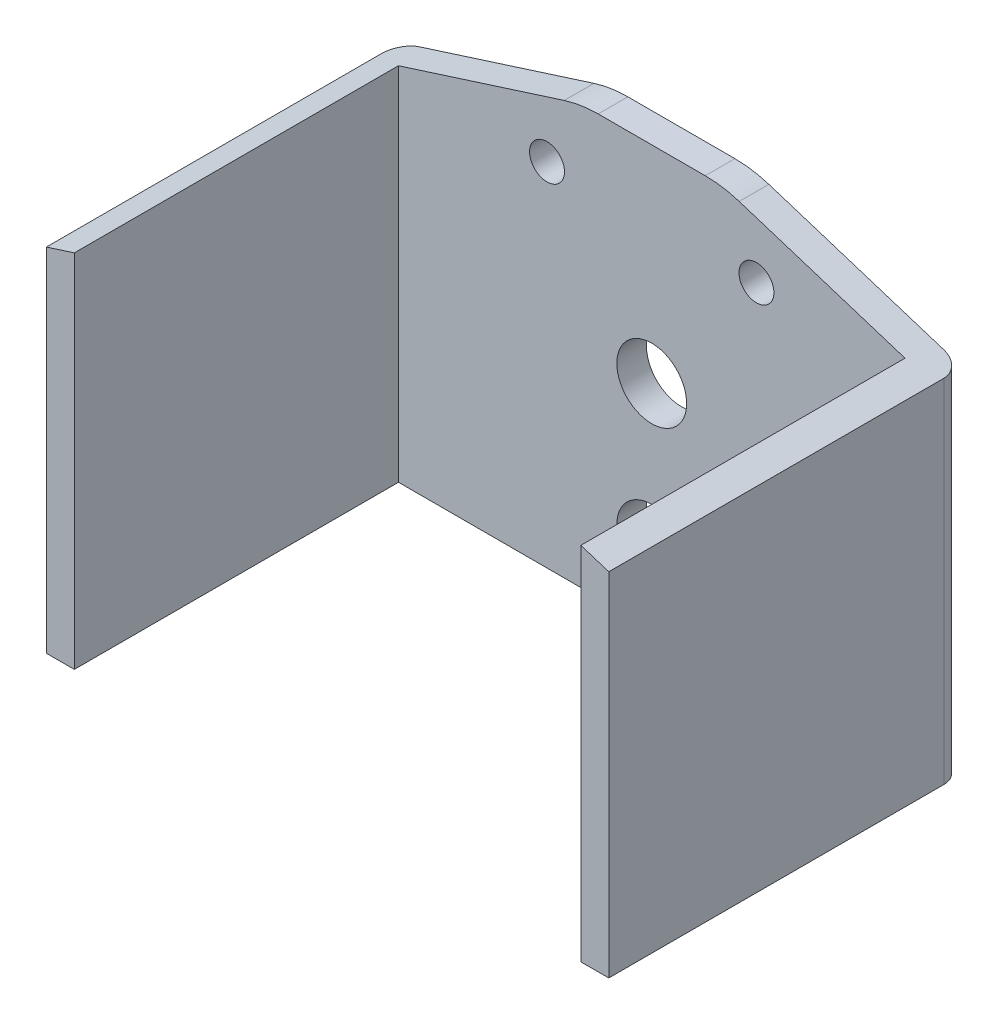
from build123d import *

# Parameters (mm, degrees)
BOSS_EXTRUDE1_DEPTH = 19.05
SKETCH9_R           = 1.5875
SKETCH9_R_2         = 0.79375
CUT_EXTRUDE3_DEPTH  = 29.02437948
FILLET1_R           = 5.08


with BuildPart() as part:
    # Sketch8 → Boss-Extrude1 (new body)
    with BuildSketch(Plane(origin=(0, 0, 0), x_dir=(1, 0, 0), z_dir=(0, 1, 0))):
        with BuildLine():
            Line((-11.938, 0), (11.938, 0))
            ThreePointArc((11.938, 0), (12.539558645, -0.249173749), (12.788732394, -0.850732394))
            Line((12.788732394, -0.850732394), (12.788732394, -16.090732394))
            Line((12.788732394, -16.090732394), (11.518732394, -16.090732394))
            Line((11.518732394, -16.090732394), (11.518732394, -1.348144756))
            Line((11.518732394, -1.348144756), (-11.518727516, -1.348144756))
            Line((-11.518727516, -1.348144756), (-11.518727516, -16.090732394))
            Line((-11.518727516, -16.090732394), (-12.788727516, -16.090732394))
            Line((-12.788727516, -16.090732394), (-12.788727516, -0.850732394))
            ThreePointArc((-12.788727516, -0.850732394), (-12.539558645, -0.249173749), (-11.938, 0))
        make_face()
    extrude(amount=BOSS_EXTRUDE1_DEPTH)

    # Sketch9 → Cut-Extrude3 (cut, through all)
    with BuildSketch(Plane(origin=(0, 0, 0), x_dir=(-1, 0, 0), z_dir=(0, 0, -1))):
        with Locations((0, 9.652)):
            Circle(SKETCH9_R)
        with Locations((0, 3.302)):
            Circle(SKETCH9_R)
        with Locations((-4.7625, 16.002)):
            Circle(SKETCH9_R_2)
        with Locations((4.7625, 16.002)):
            Circle(SKETCH9_R_2)
        Polygon((-12.788732394, 16.002), (-3.224577063, 19.05), (-12.788732394, 19.05), align=None)
        Polygon((12.788732394, 16.002), (3.224577063, 19.05), (12.788729955, 19.05), align=None)
    extrude(amount=-CUT_EXTRUDE3_DEPTH, mode=Mode.SUBTRACT)

    # Fillet1
    fillet1_edges = [part.edges().sort_by_distance(p)[0] for p in [
        (3.224577063, 19.05, 0.674072378),
        (-3.224577063, 19.05, 0.674072378),
    ]]
    fillet(fillet1_edges, radius=FILLET1_R)


solid = part.part
